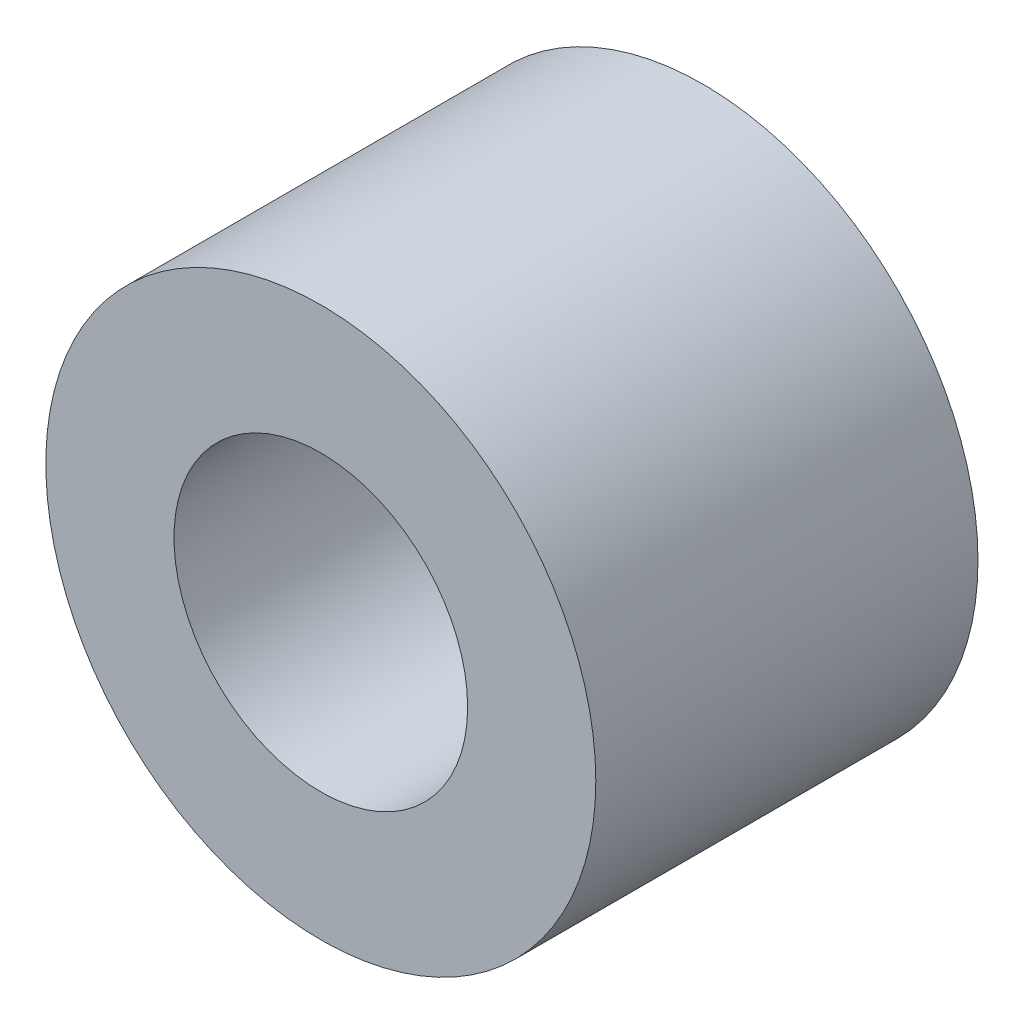
from build123d import *

# Parameters (mm, degrees)
ESQUISSE1_R        = 2.95
ESQUISSE1_R_2      = 1.575
BOSS_EXTRU_1_DEPTH = 4.1


with BuildPart() as part:
    # Esquisse1 → Boss.-Extru.1 (new body)
    with BuildSketch(Plane.XY):
        Circle(ESQUISSE1_R)
        Circle(ESQUISSE1_R_2, mode=Mode.SUBTRACT)
    extrude(amount=BOSS_EXTRU_1_DEPTH)


solid = part.part
